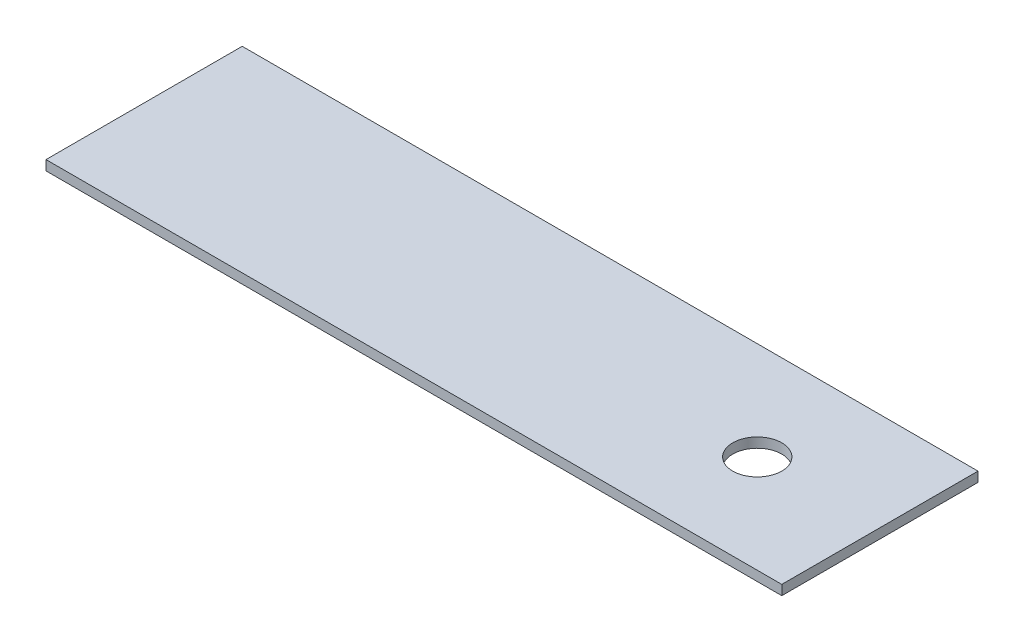
from build123d import *

# Parameters (mm, degrees)
SKETCH_1_W          = 150
SKETCH_1_H          = 40
EXTRUDE_1_DEPTH     = 2
SKETCH_2_R          = 5
CUT_EXTRUDE_1_DEPTH = 121.480372565


with BuildPart() as part:
    # 草图1 → 凸台-拉伸1 (new body)
    with BuildSketch(Plane(origin=(0, 0, 0), x_dir=(1, 0, 0), z_dir=(0, 1, 0))):
        with Locations((41.714445139, -9.820437106)):
            Rectangle(SKETCH_1_W, SKETCH_1_H)
    extrude(amount=EXTRUDE_1_DEPTH)

    # 草图2 → 切除-拉伸1 (cut, through all)
    with BuildSketch(Plane(origin=(0, 0, 0), x_dir=(1, 0, 0), z_dir=(0, 1, 0))):
        with Locations(Location((91.714445139, -9.820437106, 0), (0, 0, 270))):
            Circle(SKETCH_2_R)
    extrude(amount=CUT_EXTRUDE_1_DEPTH, mode=Mode.SUBTRACT)


solid = part.part
